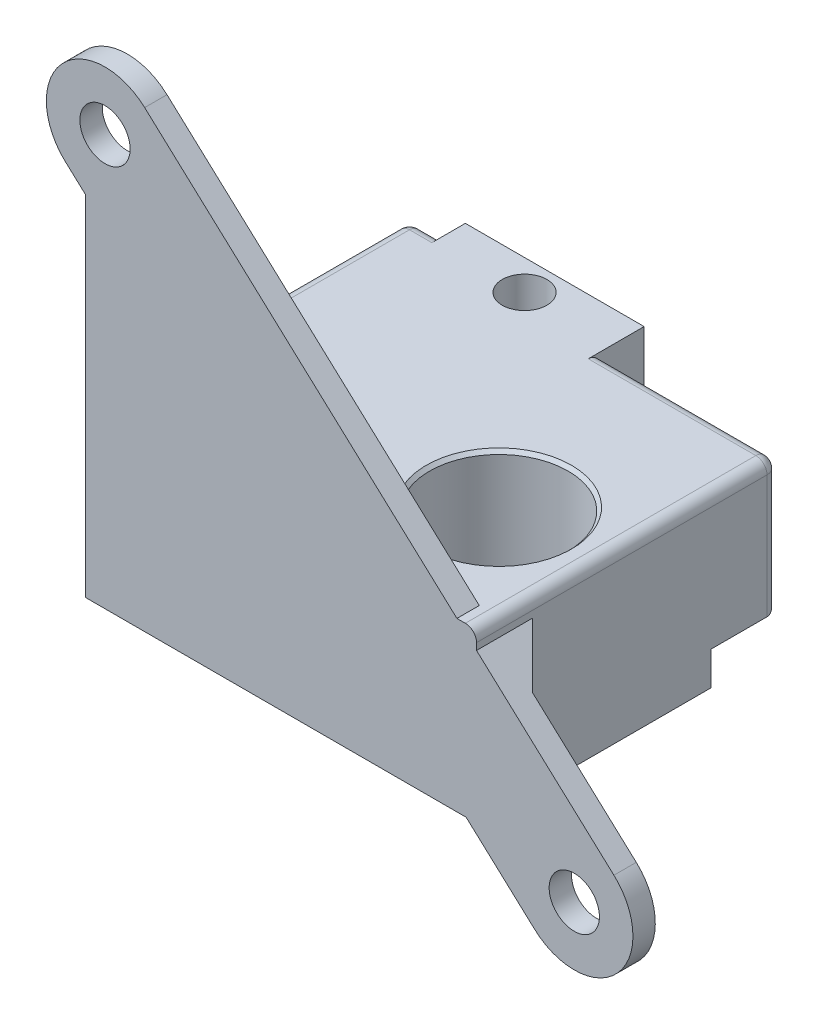
from build123d import *

# Parameters (mm, degrees)
SKETCH1_R           = 2.25
BOSS_EXTRUDE1_DEPTH = 2
SKETCH2_W           = 35
SKETCH2_H           = 15
BOSS_EXTRUDE2_DEPTH = 31
CUT_EXTRUDE1_DEPTH  = 10
SKETCH4_R           = 2
CUT_EXTRUDE2_DEPTH  = 49.3741925
CHAMFER1_SIZE       = 3
SKETCH11_W          = 16
SKETCH11_H          = 12
CUT_EXTRUDE4_DEPTH  = 4
SKETCH13_W          = 3
SKETCH13_H          = 12
CUT_EXTRUDE5_DEPTH  = 2
BOSS_EXTRUDE7_DEPTH = 2
FILLET1_R           = 1
SKETCH15_R          = 0.5
CUT_EXTRUDE6_DEPTH  = 7
CUT_EXTRUDE7_START  = -2
SKETCH16_R          = 0.5
CUT_EXTRUDE7_DEPTH  = 18


with BuildPart() as part:
    # Sketch1 → Boss-Extrude1 (new body)
    with BuildSketch(Plane.XY):
        with BuildLine():
            Line((-18.9524457, 24.370059236), (23.0475543, -14.129940764))
            ThreePointArc((23.0475543, -14.129940764), (23.370059236, -21.5475543), (15.9524457, -21.870059236))
            Line((15.9524457, -21.870059236), (-26.0475543, 16.629940764))
            ThreePointArc((-26.0475543, 16.629940764), (-26.370059236, 24.0475543), (-18.9524457, 24.370059236))
        make_face()
        with Locations((-22.5, 20.5)):
            Circle(SKETCH1_R, mode=Mode.SUBTRACT)
        with Locations((19.5, -18)):
            Circle(SKETCH1_R, mode=Mode.SUBTRACT)
    extrude(amount=BOSS_EXTRUDE1_DEPTH)

    # Sketch2 → Boss-Extrude2 (add)
    with BuildSketch(Plane(origin=(0, 0, 2), x_dir=(-1, 0, 0), z_dir=(0, 0, -1))):
        with Locations((6.75, -8.75)):
            Rectangle(SKETCH2_W, SKETCH2_H)
    extrude(amount=BOSS_EXTRUDE2_DEPTH)

    # Sketch3 → Cut-Extrude1 (cut)
    with BuildSketch(Plane(origin=(0, 0, -29), x_dir=(-1, 0, 0), z_dir=(0, 0, -1))):
        Polygon((22.25, -13.25), (22.25, -6.25), (4.25, -6.25), (4.25, -13.25), (-10.75, -13.25), (-10.75, -16.25), (24.25, -16.25), (24.25, -13.25), align=None)
    extrude(amount=-CUT_EXTRUDE1_DEPTH, mode=Mode.SUBTRACT)

    # Sketch4 → Cut-Extrude2 (cut, through all)
    with BuildSketch(Plane(origin=(0, -1.25, 0), x_dir=(1, 0, 0), z_dir=(0, 1, 0))):
        with Locations(Location((-13.25, 26.3, 0), (0, 0, 270))):
            Circle(SKETCH4_R)
    extrude(amount=-CUT_EXTRUDE2_DEPTH, mode=Mode.SUBTRACT)

    # Chamfer1
    chamfer1_edges = [part.edges().sort_by_distance(p)[0] for p in [
        (10.75, -9.553591328, 0),
    ]]
    chamfer(chamfer1_edges, length=CHAMFER1_SIZE)

    # Sketch7 → Ø12.0mm Clearance Dowel Hole1 (revolve, cut)
    with BuildSketch(Plane(origin=(2.25, -16.25, -8.5), x_dir=(0, 0, -1), z_dir=(1, 0, 0))):
        Polygon((0, 0), (0, 15), (6.5, 15), (6.2, 14.7), (6.2, 0.2), (6.4, 0), align=None)
    revolve(axis=Axis((2.25, -22.6, -8.5), (0, 1, 0)), mode=Mode.SUBTRACT)

    # Sketch11 → Cut-Extrude4 (cut)
    with BuildSketch(Plane(origin=(0, 0, -29), x_dir=(-1, 0, 0), z_dir=(0, 0, -1))):
        with Locations((-2.75, -7.25)):
            Rectangle(SKETCH11_W, SKETCH11_H)
    extrude(amount=-CUT_EXTRUDE4_DEPTH, mode=Mode.SUBTRACT)

    # Sketch13 → Cut-Extrude5 (cut)
    with BuildSketch(Plane(origin=(0, 0, -29), x_dir=(-1, 0, 0), z_dir=(0, 0, -1))):
        with Locations((22.75, -7.25)):
            Rectangle(SKETCH13_W, SKETCH13_H)
    extrude(amount=-CUT_EXTRUDE5_DEPTH, mode=Mode.SUBTRACT)

    # Sketch9 → Boss-Extrude7 (add)
    with BuildSketch(Plane(origin=(0, 0, 2), x_dir=(-1, 0, 0), z_dir=(0, 0, -1))):
        Polygon((24.25, -1.25), (24.25, 14.982182656), (6.542164375, -1.25), align=None)
    extrude(amount=BOSS_EXTRUDE7_DEPTH)

    # Fillet1
    fillet1_edges = [part.edges().sort_by_distance(p)[0] for p in [
        (10.75, -1.25, -11.5),
        (3.25, -13.25, -25),
        (10.75, -7.25, -25),
        (2.75, -1.25, -25),
        (-23.25, -13.25, -27),
        (-24.25, -1.25, -13.5),
        (-24.25, -7.25, -27),
        (-22.75, -1.25, -27),
    ]]
    fillet(fillet1_edges, radius=FILLET1_R)

    # Sketch15 → Cut-Extrude6 (cut)
    with BuildSketch(Plane.XZ.offset(13.25)):
        with Locations((-4.25, -19)):
            Circle(SKETCH15_R)
        with Locations((-22.25, -19)):
            Circle(SKETCH15_R)
    extrude(amount=-CUT_EXTRUDE6_DEPTH, mode=Mode.SUBTRACT)

    # Sketch16 → Cut-Extrude7 (cut)
    with BuildSketch(Plane.ZY.offset(24.25).offset(CUT_EXTRUDE7_START)):
        with Locations((-19, -6.25)):
            Circle(SKETCH16_R)
    extrude(amount=-CUT_EXTRUDE7_DEPTH, mode=Mode.SUBTRACT)


solid = part.part
